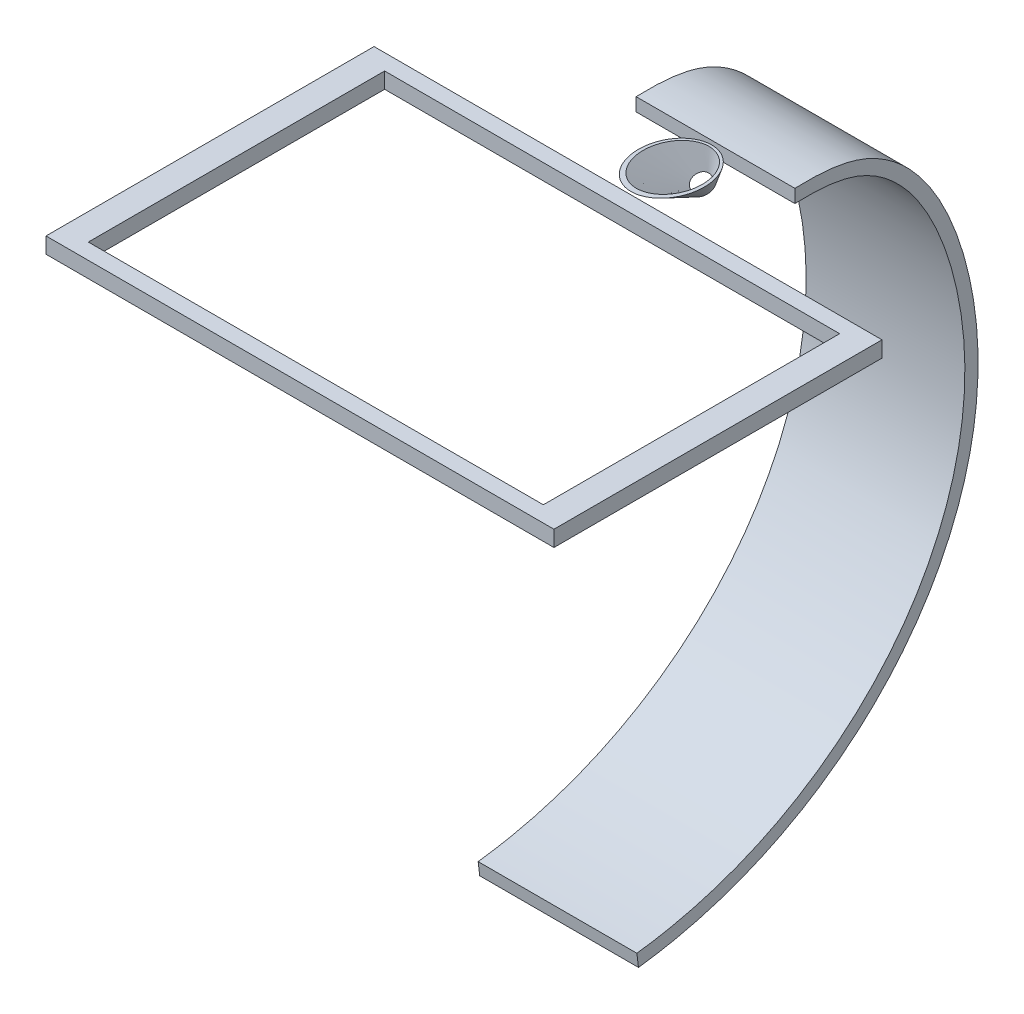
from build123d import *

# Parameters (mm, degrees)
SKETCH1_W                = 96
SKETCH1_H                = 62
SKETCH1_W_2              = 86
SKETCH1_H_2              = 56
BOSS_EXTRUDE1_DEPTH      = 3
CUT_EXTRUDE1_DEPTH       = 80.713392874
CUT_EXTRUDE1_DEPTH_BACK  = 80.713392874
SKETCH6_W                = 96
SKETCH6_H                = 13.293726608
BOSS_EXTRUDE4_DEPTH      = 15
BOSS_EXTRUDE4_DEPTH_BACK = 15


with BuildPart() as part:
    # Sketch1 → Boss-Extrude1 (new body)
    with BuildSketch(Plane(origin=(0, 0, 0), x_dir=(1, 0, 0), z_dir=(0, 1, 0))):
        Rectangle(SKETCH1_W, SKETCH1_H)
        Rectangle(SKETCH1_W_2, SKETCH1_H_2, mode=Mode.SUBTRACT)
    extrude(amount=BOSS_EXTRUDE1_DEPTH)


with BuildPart() as body_2:
    # Sketch5 → Revolve4 (revolve)
    with BuildSketch(Plane(origin=(0, 0, 0), x_dir=(0, 0, -1), z_dir=(1, 0, 0))):
        Polygon((42.847766111, -3.264000825), (43.35293319, -2.972342476), (32.435517398, 3.079279916), (29.397254743, 4.191739373), align=None)
    revolve(axis=Axis((0, -3.698755296, -45.694749278), (0, 0.8660254037844369, 0.500000000000003)))

    # Sketch6 → Cut-Extrude1 (cut, two sides: drawn at the far end of the back side and taken through both)
    with BuildSketch(Plane(origin=(0, 0, -31), x_dir=(-1, 0, 0), z_dir=(0, 0, -1)).offset(-CUT_EXTRUDE1_DEPTH_BACK)):
        with Locations((0, 9.646863304)):
            Rectangle(SKETCH6_W, SKETCH6_H)
    extrude(amount=CUT_EXTRUDE1_DEPTH + CUT_EXTRUDE1_DEPTH_BACK, mode=Mode.SUBTRACT)


with BuildPart() as body_3:
    # Sketch8 → Boss-Extrude4 (new, two sides: drawn at the far end of the back side and taken through both)
    with BuildSketch(Plane(origin=(0, 0, 0), x_dir=(0, 0, -1), z_dir=(1, 0, 0)).offset(-BOSS_EXTRUDE4_DEPTH_BACK)):
        with BuildLine():
            add(Edge.make_bspline(
                [(47.531164419, 3.030978584), (48.009584276, 3.046669454), (49.732376843, 3.086879364), (53.384684416, 3.015943662), (57.479184653, 2.430682323), (61.13151972, 1.154527365), (64.523530603, -0.579248262), (68.302915016, -3.495135949), (73.380871896, -9.384814257), (78.075335274, -18.459460773), (81.383893935, -30.548283247), (82.508549274, -42.350469107), (81.580412229, -53.692183539), (78.741723123, -64.418039329), (74.142405699, -74.372744484), (67.936037484, -83.409767304), (60.275822495, -91.388619366), (51.313224287, -98.172791495), (42.882505577, -102.718417904), (35.636589118, -105.622711347), (29.965316017, -107.418579535), (24.094596986, -108.812948877), (20.012916325, -109.469520478), (17.977331626, -109.721308507)],
                knots=[0.096923151, 0.096923151, 0.096923151, 0.096923151, 0.104735651, 0.125, 0.15625, 0.171875, 0.1875, 0.21875, 0.25, 0.3125, 0.375, 0.4375, 0.5, 0.5625, 0.625, 0.6875, 0.75, 0.8125, 0.875, 0.90625, 0.9375, 0.96875, 1, 1, 1, 1], degree=3))
            Line((47.531164419, 3.030978584), (47.531164419, 0.529588868))
            add(Edge.make_bspline(
                [(47.531164419, 0.529588868), (51.406061382, 0.660967006), (67.78011602, -0.083857455), (83.703241013, -33.965068364), (74.432168029, -82.485710543), (41.81520848, -104.253672305), (17.670437403, -107.240216824)],
                knots=[0.096461977, 0.096461977, 0.096461977, 0.096461977, 0.161872348, 0.377929861, 0.621899943, 1, 1, 1, 1], degree=3))
            Line((17.670437403, -107.240216824), (17.977331626, -109.721308507))
        make_face()
    extrude(amount=BOSS_EXTRUDE4_DEPTH + BOSS_EXTRUDE4_DEPTH_BACK)


solid = Compound([part.part, body_2.part, body_3.part])
